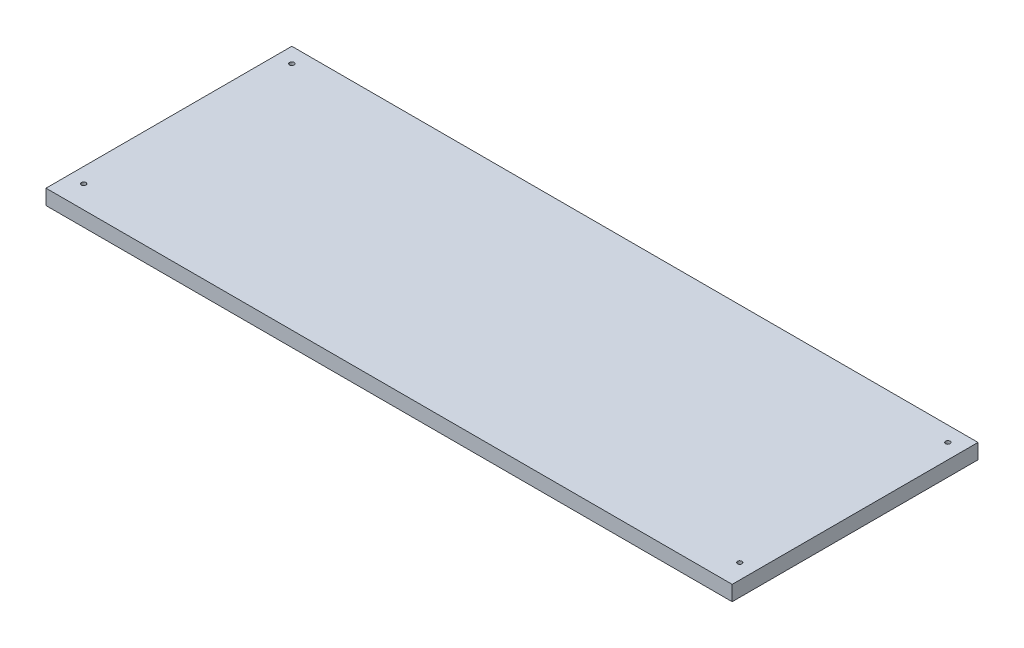
from build123d import *

# Parameters (mm, degrees)
SKETCH1_W                   = 455
SKETCH1_H                   = 163
BOSS_EXTRUDE1_DEPTH         = 10
F_32_0_116_DIAMETER_HOLE1_D = 3.000000096


with BuildPart() as part:
    # Sketch1 → Boss-Extrude1 (new body)
    with BuildSketch(Plane(origin=(0, 0, 0), x_dir=(1, 0, 0), z_dir=(0, 1, 0))):
        Rectangle(SKETCH1_W, SKETCH1_H)
    extrude(amount=BOSS_EXTRUDE1_DEPTH)

    # #32 (0.116) Diameter Hole1 (through all)
    with Locations(Plane(origin=(0, 10, 0), x_dir=(1, 0, 0), z_dir=(0, 1, 0))):
        with Locations((217.5, -66.5), (217.5, 71.5), (-217.5, 71.5), (-217.5, -66.5)):
            Hole(F_32_0_116_DIAMETER_HOLE1_D / 2)


solid = part.part
